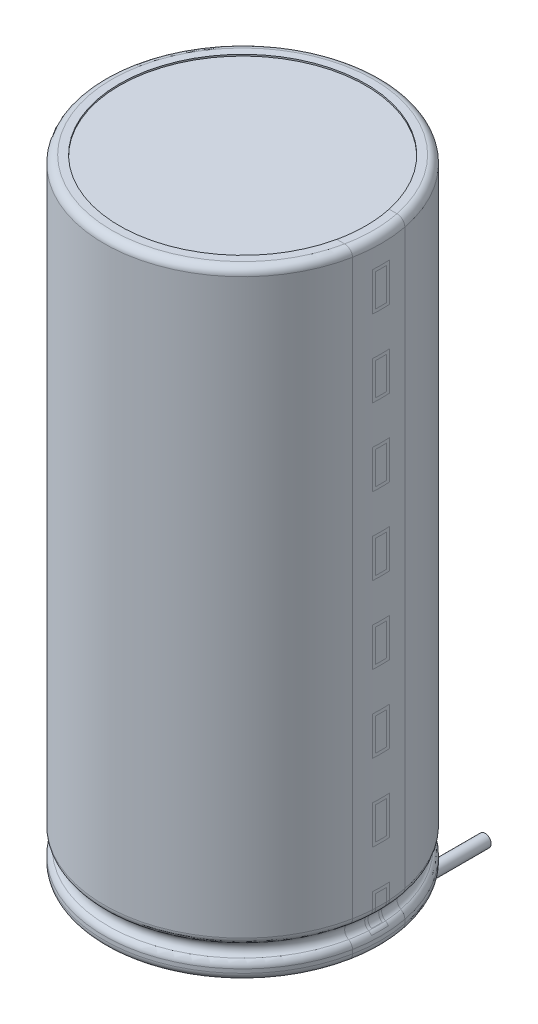
from build123d import *

# Parameters (mm, degrees)
SKETCH1_R = 0.4


with BuildPart() as part:
    # По траектории1: sweep along a path in Эскиз1
    with BuildLine(Plane(origin=(0, 0, 0), x_dir=(0, 0, -1), z_dir=(1, 0, 0))) as sweep_1_path:
        Line((3, -2.5), (-7, -2.5))
        ThreePointArc((-7, -2.5), (-8.414213562, -1.914213562), (-9, -0.5))
        Line((-9, -0.5), (-9, 0))
        Line((-9, 0), (-9, 1))
    # Sketch1 → По траектории1 (sweep)
    with BuildSketch(Plane(origin=(0, 0, 0), x_dir=(1, 0, 0), z_dir=(0, 1, 0))):
        with Locations((-3.75, -9)):
            Circle(SKETCH1_R)
        with Locations((3.75, -9)):
            Circle(SKETCH1_R)
    sweep(path=sweep_1_path.line)


with BuildPart() as body_2:
    # Sketch3 → Revolve1 (revolve)
    with BuildSketch(Plane.XY.offset(9)):
        with BuildLine():
            Line((9, 0.5), (9, 0.75))
            ThreePointArc((9, 0.75), (8.933012702, 1), (8.75, 1.183012702))
            ThreePointArc((8.75, 1.183012702), (8.5, 1.616025404), (8.75, 2.049038106))
            ThreePointArc((8.75, 2.049038106), (8.933012702, 2.232050808), (9, 2.482050808))
            Line((9, 2.482050808), (9, 39.7))
            ThreePointArc((9, 39.7), (8.853553391, 40.053553391), (8.5, 40.2))
            Line((8.5, 40.2), (8, 40.2))
            Line((8, 40.2), (8, 40.1))
            Line((8, 40.1), (0, 40.1))
            Line((0, 40.1), (0, 0.1))
            Line((0, 0.1), (8, 0.1))
            Line((8, 0.1), (8, 0))
            Line((8, 0), (8.5, 0))
            ThreePointArc((8.5, 0), (8.853553391, 0.146446609), (9, 0.5))
        make_face()
    revolve(axis=Axis((0, 0.1, 9), (0, 1, 0)))


solid = Compound([part.part, body_2.part])
